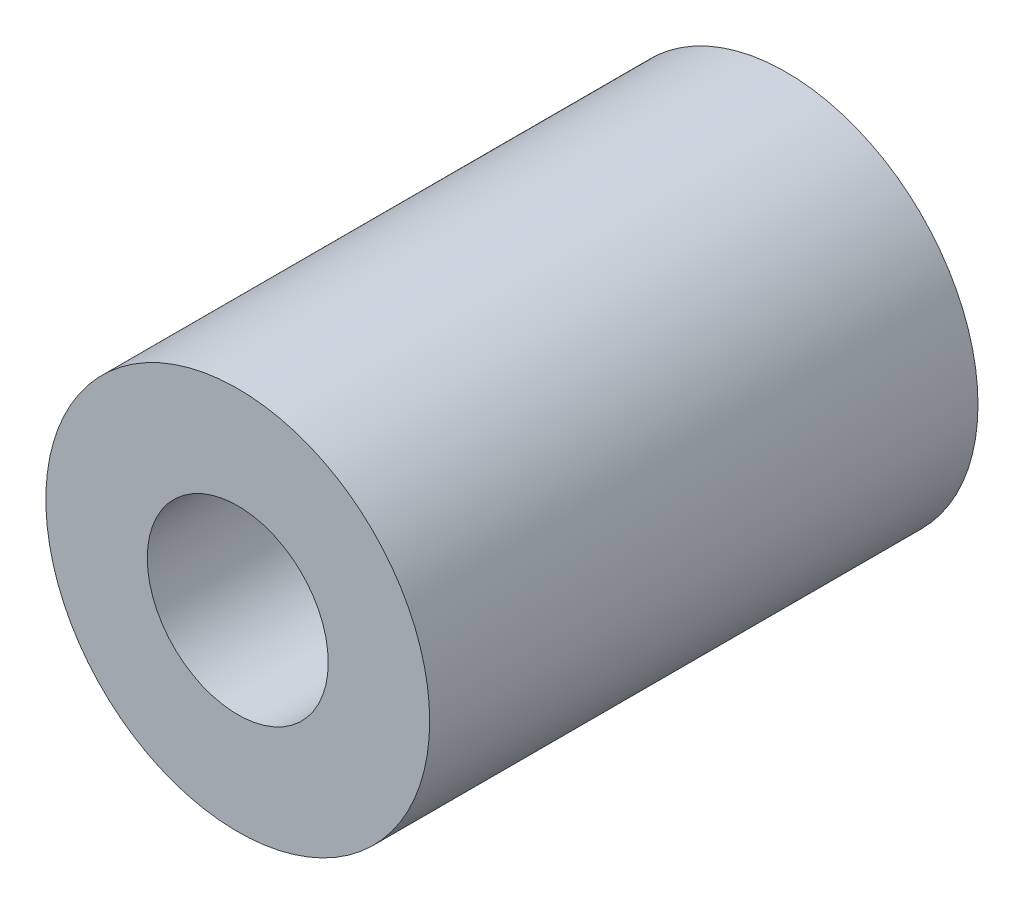
from build123d import *

# Parameters (mm, degrees)
SKETCH_1_R      = 3.5
SKETCH_1_R_2    = 1.65
EXTRUDE_1_DEPTH = 10


with BuildPart() as part:
    # 草图1 → 凸台-拉伸1 (new body)
    with BuildSketch(Plane.XY):
        Circle(SKETCH_1_R)
        Circle(SKETCH_1_R_2, mode=Mode.SUBTRACT)
    extrude(amount=EXTRUDE_1_DEPTH)


solid = part.part
